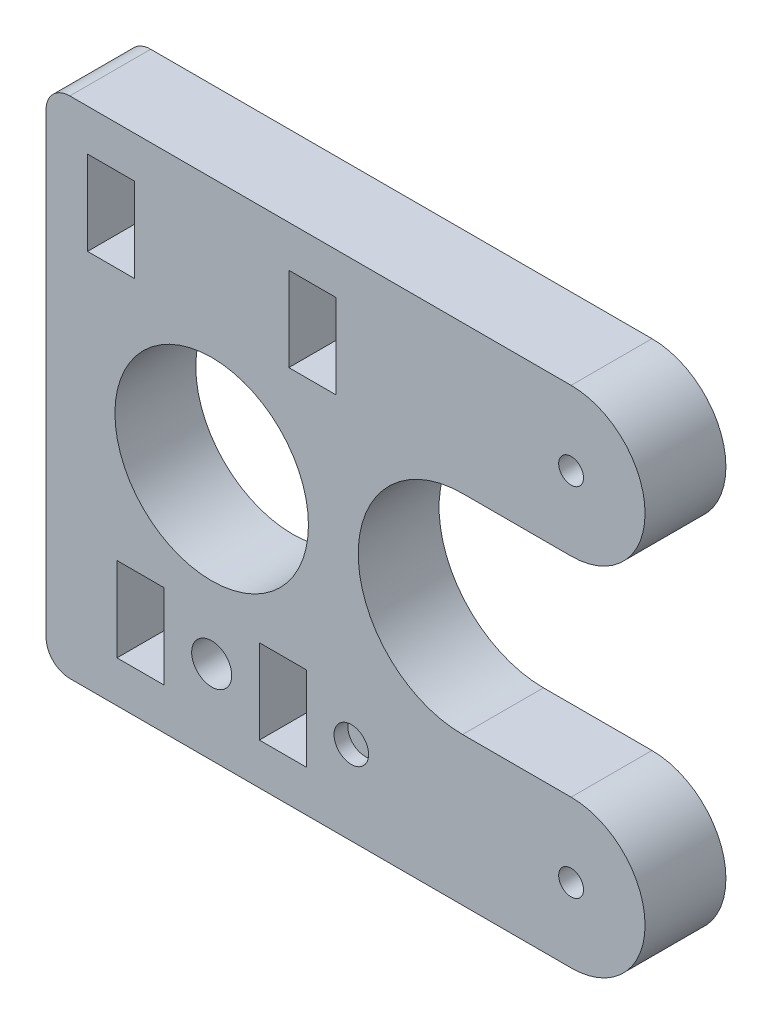
from build123d import *

# Parameters (mm, degrees)
SKETCH1_R           = 0.9
SKETCH1_R_2         = 1.45
SKETCH1_R_3         = 7
SKETCH1_W           = 3.400011
SKETCH1_H           = 6.1
SKETCH1_W_2         = 3.4
BOSS_EXTRUDE2_DEPTH = 5.85
SKETCH2_R           = 1.25
CUT_EXTRUDE1_DEPTH  = 1


with BuildPart() as part:
    # Sketch1 → Boss-Extrude2 (new body)
    with BuildSketch(Plane.XY):
        with BuildLine():
            Line((669.21684417, 349.01545661), (648.4638119, 349.01545661))
            ThreePointArc((648.4638119, 349.01545661), (647.249496344, 348.512470637), (646.746510371, 347.298155081))
            Line((646.746510371, 347.298155081), (646.746510371, 314.232758138))
            ThreePointArc((646.746510371, 314.232758138), (647.249496344, 313.018442582), (648.4638119, 312.51545661))
            Line((648.4638119, 312.51545661), (669.21684417, 312.51545661))
            Line((669.21684417, 312.51545661), (684.726521371, 312.51545661))
            ThreePointArc((684.726521371, 312.51545661), (690.076521371, 317.86545661), (684.726521371, 323.21545661))
            Line((684.726521371, 323.21545661), (676.876521371, 323.21545661))
            ThreePointArc((676.876521371, 323.21545661), (669.326521371, 330.76545661), (676.876521371, 338.31545661))
            Line((676.876521371, 338.31545661), (684.726521371, 338.31545661))
            ThreePointArc((684.726521371, 338.31545661), (690.076521371, 343.66545661), (684.726521371, 349.01545661))
            Line((684.726521371, 349.01545661), (669.21684417, 349.01545661))
        make_face()
        with Locations((684.726521371, 343.66545661)):
            Circle(SKETCH1_R, mode=Mode.SUBTRACT)
        with Locations((684.726521371, 317.86545661)):
            Circle(SKETCH1_R, mode=Mode.SUBTRACT)
        with Locations((658.726521371, 318.56545661)):
            Circle(SKETCH1_R_2, mode=Mode.SUBTRACT)
        with Locations((658.726521371, 330.76545661)):
            Circle(SKETCH1_R_3, mode=Mode.SUBTRACT)
        with Locations((651.446515871, 342.96545661)):
            Rectangle(SKETCH1_W, SKETCH1_H, mode=Mode.SUBTRACT)
        with Locations((653.576521371, 318.56545661)):
            Rectangle(SKETCH1_W_2, SKETCH1_H, mode=Mode.SUBTRACT)
        with Locations((666.006526871, 342.96545661)):
            Rectangle(SKETCH1_W, SKETCH1_H, mode=Mode.SUBTRACT)
        with Locations((663.876521371, 318.56545661)):
            Rectangle(SKETCH1_W_2, SKETCH1_H, mode=Mode.SUBTRACT)
    extrude(amount=BOSS_EXTRUDE2_DEPTH)

    # Sketch2 → Cut-Extrude1 (cut)
    with BuildSketch(Plane.XY.offset(5.85)):
        with Locations((668.826521371, 318.56545661)):
            Circle(SKETCH2_R)
    extrude(amount=-CUT_EXTRUDE1_DEPTH, mode=Mode.SUBTRACT)


solid = part.part
